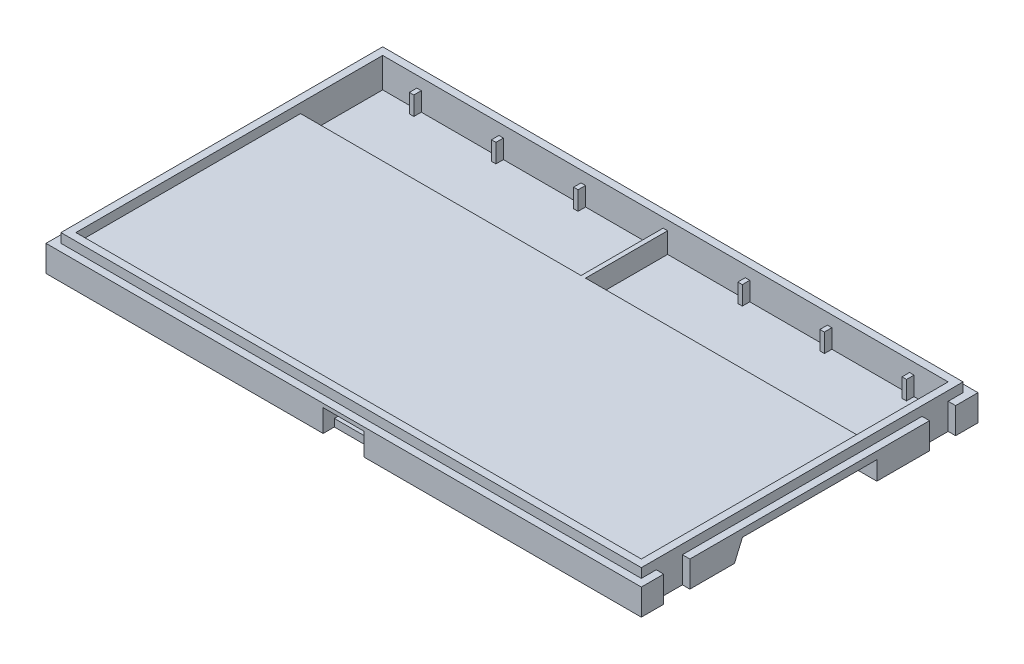
from build123d import *

# Parameters (mm, degrees)
SKETCH_1_W                 = 159.5
SKETCH_1_H                 = 90.2
EXTRUDE_1_DEPTH            = 9.5
SKETCH_2_W                 = 163.5
SKETCH_2_H                 = 94.2
SKETCH_2_W_2               = 155.5
SKETCH_2_H_2               = 86.2
CUT_EXTRUDE_1_DEPTH        = 2.5
SKETCH_3_W                 = 151.5
SKETCH_3_H                 = 82.2
CUT_EXTRUDE_2_DEPTH        = 2.5
SKETCH_4_W                 = 151.5
SKETCH_4_H                 = 22
CUT_EXTRUDE_3_DEPTH        = 5.5
SKETCH_5_W                 = 1.2
SKETCH_5_H                 = 22
EXTRUDE_2_DEPTH            = 5.5
SKETCH_7_W                 = 1.2
SKETCH_7_H                 = 2
EXTRUDE_4_DEPTH            = 5
PATTERN_LINEAR_1_COUNT     = 4
PATTERN_LINEAR_1_PITCH     = 22
PATTERN_LINEAR_1_COL_COUNT = 4
PATTERN_LINEAR_1_COL_PITCH = 22
SKETCH_8_W                 = 2
SKETCH_8_H                 = 7
CUT_EXTRUDE_4_DEPTH        = 92.886193196
CUT_EXTRUDE_5_DEPTH        = 167.025630551
EXTRUDE_5_DEPTH            = 2.5
PATTERN_LINEAR_2_COUNT     = 2
PATTERN_LINEAR_2_PITCH     = 72
PATTERN_LINEAR_2_COL_COUNT = 2
PATTERN_LINEAR_2_COL_PITCH = 72
SKETCH_11_W                = 153.5
SKETCH_11_H                = 15.6
CUT_EXTRUDE_6_DEPTH        = 5
SKETCH_12_W                = 156.5
SKETCH_12_H                = 10
CUT_EXTRUDE_7_DEPTH        = 5
SKETCH_13_W                = 32
SKETCH_13_H                = 10
CUT_EXTRUDE_8_DEPTH        = 5
EXTRUDE_6_DEPTH            = 5
SKETCH_15_W                = 14
SKETCH_15_H                = 18.6
EXTRUDE_7_DEPTH            = 5
SKETCH_16_W                = 11
SKETCH_16_H                = 6
SKETCH_16_H_2              = 5
CUT_EXTRUDE_9_DEPTH        = 5
SKETCH_17_W                = 11
SKETCH_17_H                = 4
CUT_EXTRUDE_10_DEPTH       = 50


with BuildPart() as part:
    # Эскиз1 → Бобышка-Вытянуть1 (new body)
    with BuildSketch(Plane(origin=(0, 0, 0), x_dir=(1, 0, 0), z_dir=(0, 1, 0))):
        Rectangle(SKETCH_1_W, SKETCH_1_H)
    extrude(amount=EXTRUDE_1_DEPTH)

    # Эскиз2 → Вырез-Вытянуть1 (cut)
    with BuildSketch(Plane(origin=(0, 9.5, 0), x_dir=(1, 0, 0), z_dir=(0, 1, 0))):
        Rectangle(SKETCH_2_W, SKETCH_2_H)
        Rectangle(SKETCH_2_W_2, SKETCH_2_H_2, mode=Mode.SUBTRACT)
    extrude(amount=-CUT_EXTRUDE_1_DEPTH, mode=Mode.SUBTRACT)

    # Эскиз3 → Вырез-Вытянуть2 (cut)
    with BuildSketch(Plane(origin=(0, 9.5, 0), x_dir=(1, 0, 0), z_dir=(0, 1, 0))):
        Rectangle(SKETCH_3_W, SKETCH_3_H)
    extrude(amount=-CUT_EXTRUDE_2_DEPTH, mode=Mode.SUBTRACT)

    # Эскиз4 → Вырез-Вытянуть3 (cut)
    with BuildSketch(Plane(origin=(0, 7, 0), x_dir=(1, 0, 0), z_dir=(0, 1, 0))):
        with Locations((0, 30.1)):
            Rectangle(SKETCH_4_W, SKETCH_4_H)
    extrude(amount=-CUT_EXTRUDE_3_DEPTH, mode=Mode.SUBTRACT)

    # Эскиз5 → Бобышка-Вытянуть2 (add)
    with BuildSketch(Plane(origin=(0, 1.5, 0), x_dir=(1, 0, 0), z_dir=(0, 1, 0))):
        with Locations((0, 30.1)):
            Rectangle(SKETCH_5_W, SKETCH_5_H)
    extrude(amount=EXTRUDE_2_DEPTH)

    # Эскиз7 → Бобышка-Вытянуть4 (add)
    with BuildSketch(Plane(origin=(0, 1.5, 0), x_dir=(1, 0, 0), z_dir=(0, 1, 0))):
        with Locations((0, 40.1)):
            Rectangle(SKETCH_7_W, SKETCH_7_H)
    extrude_4 = extrude(amount=EXTRUDE_4_DEPTH)

    # Линейный массив1: Бобышка-Вытянуть4 ×4
    with Locations(*[(-i * PATTERN_LINEAR_1_PITCH, 0, 0) for i in range(1, PATTERN_LINEAR_1_COUNT)]):
        add(extrude_4)

    # Линейный массив1 col: Бобышка-Вытянуть4 ×4
    with Locations(*[(i * PATTERN_LINEAR_1_COL_PITCH, 0, 0) for i in range(1, PATTERN_LINEAR_1_COL_COUNT)]):
        add(extrude_4)

    # Эскиз8 → Вырез-Вытянуть4 (cut, through all)
    with BuildSketch(Plane(origin=(0, 7, 0), x_dir=(1, 0, 0), z_dir=(0, 1, 0))):
        with Locations((78.75, 35.6)):
            Rectangle(SKETCH_8_W, SKETCH_8_H)
        with Locations((78.75, -35.6)):
            Rectangle(SKETCH_8_W, SKETCH_8_H)
    cut_extrude_4 = extrude(amount=-CUT_EXTRUDE_4_DEPTH, mode=Mode.SUBTRACT)

    # Зеркальное отражение1: Вырез-Вытянуть4 across plane
    add(cut_extrude_4.mirror(Plane(origin=(0, 0, 0), x_dir=(0, 0, 1), z_dir=(1, 0, 0))), mode=Mode.SUBTRACT)

    # Эскиз9 → Вырез-Вытянуть5 (cut, through all)
    with BuildSketch(Plane(origin=(79.75, 0, 0), x_dir=(0, 0, -1), z_dir=(1, 0, 0))):
        Polygon((-21, -2), (-18, 5), (18, 5), (18, -2), align=None)
    extrude(amount=-CUT_EXTRUDE_5_DEPTH, mode=Mode.SUBTRACT)

    # Эскиз10 → Бобышка-Вытянуть5 (add, symmetric)
    with BuildSketch(Plane(origin=(0, 0, 0), x_dir=(0, 0, -1), z_dir=(1, 0, 0))):
        Polygon((18, 0), (15, 0), (15, 2.5), (17.6, 3.6), (17.6, 5.1), (18.1, 5.1), (18.1, 0), align=None)
    extrude_5 = extrude(amount=EXTRUDE_5_DEPTH, both=True)

    # Линейный массив2: Бобышка-Вытянуть5 ×2
    with Locations(*[(i * PATTERN_LINEAR_2_PITCH, 0, 0) for i in range(1, PATTERN_LINEAR_2_COUNT)]):
        add(extrude_5)

    # Линейный массив2 col: Бобышка-Вытянуть5 ×2
    with Locations(*[(-i * PATTERN_LINEAR_2_COL_PITCH, 0, 0) for i in range(1, PATTERN_LINEAR_2_COL_COUNT)]):
        add(extrude_5)

    # Эскиз11 → Вырез-Вытянуть6 (cut)
    with BuildSketch(Plane.XZ):
        with Locations((0, 35.8)):
            Rectangle(SKETCH_11_W, SKETCH_11_H)
    extrude(amount=-CUT_EXTRUDE_6_DEPTH, mode=Mode.SUBTRACT)

    # Эскиз12 → Вырез-Вытянуть7 (cut)
    with BuildSketch(Plane.XZ):
        with Locations((0, 21.5)):
            Rectangle(SKETCH_12_W, SKETCH_12_H)
    extrude(amount=-CUT_EXTRUDE_7_DEPTH, mode=Mode.SUBTRACT)

    # Эскиз13 → Вырез-Вытянуть8 (cut)
    with BuildSketch(Plane.XZ):
        with Locations((0, 28.6)):
            Rectangle(SKETCH_13_W, SKETCH_13_H)
    extrude(amount=-CUT_EXTRUDE_8_DEPTH, mode=Mode.SUBTRACT)

    # Эскиз14 → Бобышка-Вытянуть6 (add)
    with BuildSketch(Plane.XZ.offset(-5)):
        Polygon((-16, 28), (-16, 36.5), (16, 36.5), (16, 28), (17.5, 28), (17.5, 38), (-17.5, 38), (-17.5, 28), align=None)
    extrude(amount=EXTRUDE_6_DEPTH)

    # Эскиз15 → Бобышка-Вытянуть7 (add)
    with BuildSketch(Plane.XZ.offset(-5)):
        with Locations((0, 35.8)):
            Rectangle(SKETCH_15_W, SKETCH_15_H)
    extrude(amount=EXTRUDE_7_DEPTH)

    # Эскиз16 → Вырез-Вытянуть9 (cut)
    with BuildSketch(Plane.XZ):
        with Locations((0, 34.5)):
            Rectangle(SKETCH_16_W, SKETCH_16_H)
        with Locations((0, 44.6)):
            Rectangle(SKETCH_16_W, SKETCH_16_H_2)
    extrude(amount=-CUT_EXTRUDE_9_DEPTH, mode=Mode.SUBTRACT)

    # Эскиз17 → Вырез-Вытянуть10 (cut)
    with BuildSketch(Plane.XY.offset(45.1)):
        with Locations((0, 4)):
            Rectangle(SKETCH_17_W, SKETCH_17_H)
    extrude(amount=-CUT_EXTRUDE_10_DEPTH, mode=Mode.SUBTRACT)


solid = part.part
